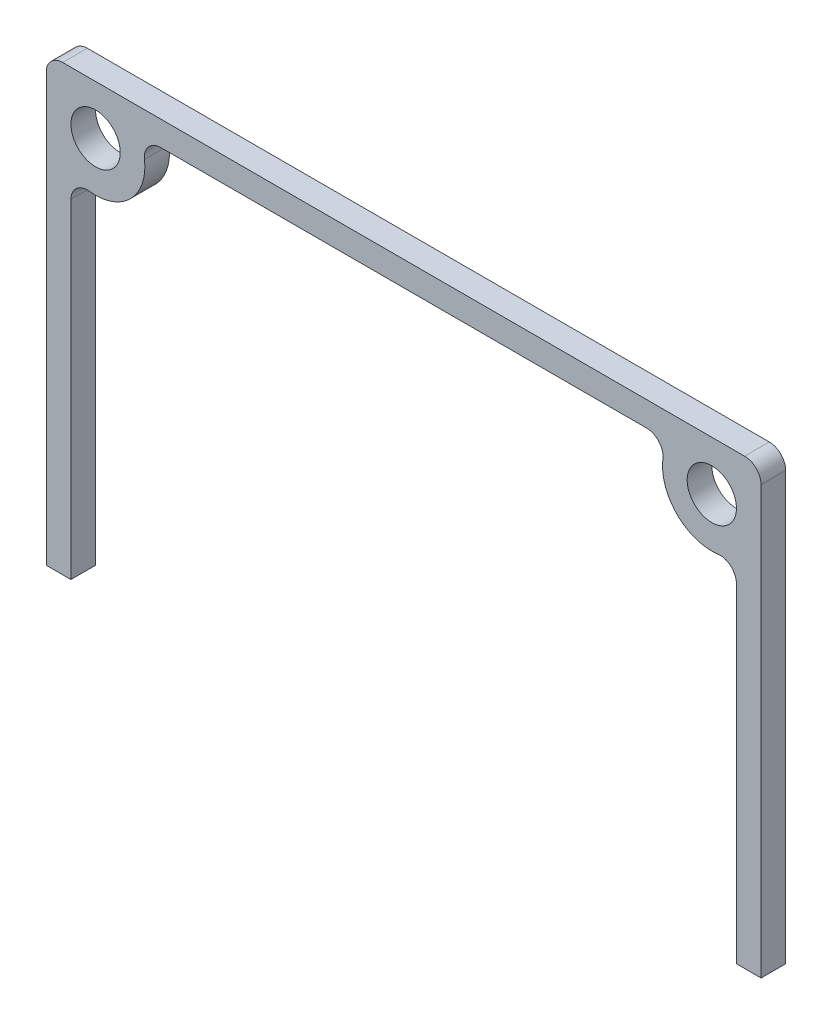
from build123d import *

# Parameters (mm, degrees)
SKETCH1_R           = 19.05
BOSS_EXTRUDE1_DEPTH = 19.05


with BuildPart() as part:
    # Sketch1 → Boss-Extrude1 (new body)
    with BuildSketch(Plane.XY):
        with BuildLine():
            Line((276.225, 0), (276.225, 330.2))
            ThreePointArc((276.225, 330.2), (272.505256121, 339.180256121), (263.525, 342.9))
            Line((263.525, 342.9), (-263.525, 342.9))
            ThreePointArc((-263.525, 342.9), (-272.505256121, 339.180256121), (-276.225, 330.2))
            Line((-276.225, 330.2), (-276.225, 0))
            Line((-276.225, 0), (-257.175, 0))
            Line((-257.175, 0), (-257.175, 76.2))
            Line((-257.175, 76.2), (-257.175, 165.1))
            Line((-257.175, 165.1), (-257.175, 254.398437524))
            ThreePointArc((-257.175, 254.398437524), (-252.875260413, 263.923437524), (-242.8875, 266.998828143))
            ThreePointArc((-242.8875, 266.998828143), (-211.184231637, 277.859231637), (-200.323828143, 309.5625))
            ThreePointArc((-200.323828143, 309.5625), (-197.248437524, 319.550260413), (-187.723437524, 323.85))
            Line((-187.723437524, 323.85), (187.723437524, 323.85))
            ThreePointArc((187.723437524, 323.85), (197.248437524, 319.550260413), (200.323828143, 309.5625))
            ThreePointArc((200.323828143, 309.5625), (211.184231637, 277.859231637), (242.8875, 266.998828143))
            ThreePointArc((242.8875, 266.998828143), (252.875260413, 263.923437524), (257.175, 254.398437524))
            Line((257.175, 254.398437524), (257.175, 165.1))
            Line((257.175, 165.1), (257.175, 76.2))
            Line((257.175, 76.2), (257.175, 0))
            Line((257.175, 0), (276.225, 0))
        make_face()
        with Locations(Location((238.125, 304.8, 0), (0, 0, 180))):
            Circle(SKETCH1_R, mode=Mode.SUBTRACT)
        with Locations(Location((-238.125, 304.8, 0), (0, 0, 180))):
            Circle(SKETCH1_R, mode=Mode.SUBTRACT)
    extrude(amount=BOSS_EXTRUDE1_DEPTH)


solid = part.part
